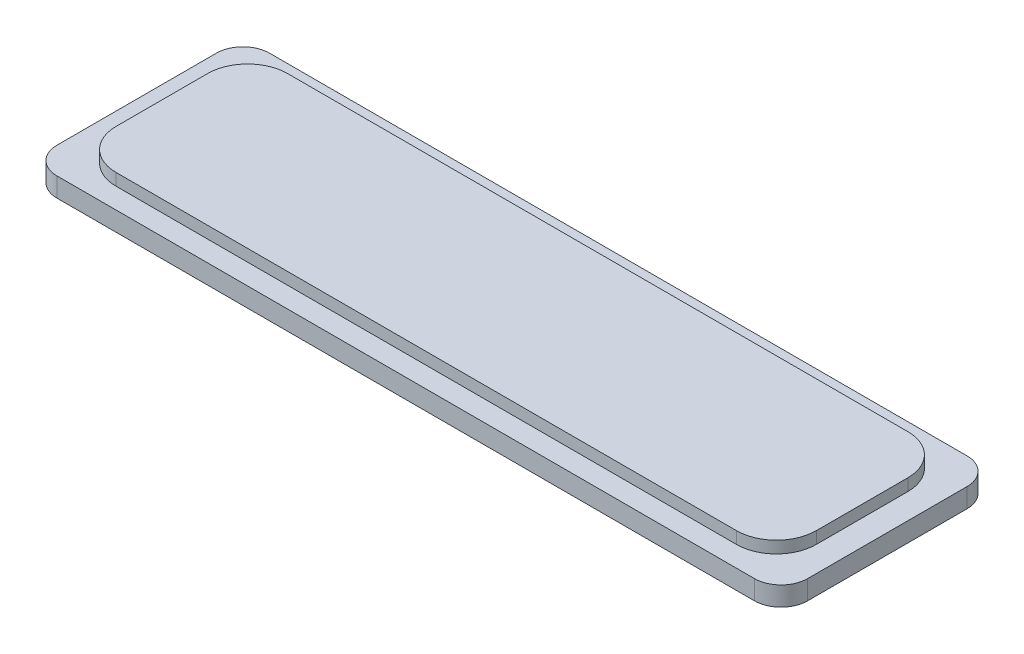
from build123d import *

# Parameters (mm, degrees)
BOSS_EXTRUDE1_DEPTH = 1.45
BOSS_EXTRUDE2_DEPTH = 0.9


with BuildPart() as part:
    # Sketch1 → Boss-Extrude1 (new body)
    with BuildSketch(Plane(origin=(0, 0, 0), x_dir=(1, 0, 0), z_dir=(0, 1, 0))):
        with BuildLine():
            Line((-26.25, -8), (26.25, -8))
            ThreePointArc((26.25, -8), (27.664213562, -7.414213562), (28.25, -6))
            Line((28.25, -6), (28.25, 6))
            ThreePointArc((28.25, 6), (27.664213562, 7.414213562), (26.25, 8))
            Line((26.25, 8), (-26.25, 8))
            ThreePointArc((-26.25, 8), (-27.664213562, 7.414213562), (-28.25, 6))
            Line((-28.25, 6), (-28.25, -6))
            ThreePointArc((-28.25, -6), (-27.664213562, -7.414213562), (-26.25, -8))
        make_face()
    extrude(amount=BOSS_EXTRUDE1_DEPTH)

    # Sketch2 → Boss-Extrude2 (add)
    with BuildSketch(Plane(origin=(0, 1.45, 0), x_dir=(1, 0, 0), z_dir=(0, 1, 0))):
        with BuildLine():
            Line((-23.35, -6.45), (23.35, -6.45))
            ThreePointArc((23.35, -6.45), (25.471320344, -5.571320344), (26.35, -3.45))
            Line((26.35, -3.45), (26.35, 3.45))
            ThreePointArc((26.35, 3.45), (25.471320344, 5.571320344), (23.35, 6.45))
            Line((23.35, 6.45), (-23.35, 6.45))
            ThreePointArc((-23.35, 6.45), (-25.471320344, 5.571320344), (-26.35, 3.45))
            Line((-26.35, 3.45), (-26.35, -3.45))
            ThreePointArc((-26.35, -3.45), (-25.471320344, -5.571320344), (-23.35, -6.45))
        make_face()
    extrude(amount=BOSS_EXTRUDE2_DEPTH)


solid = part.part
